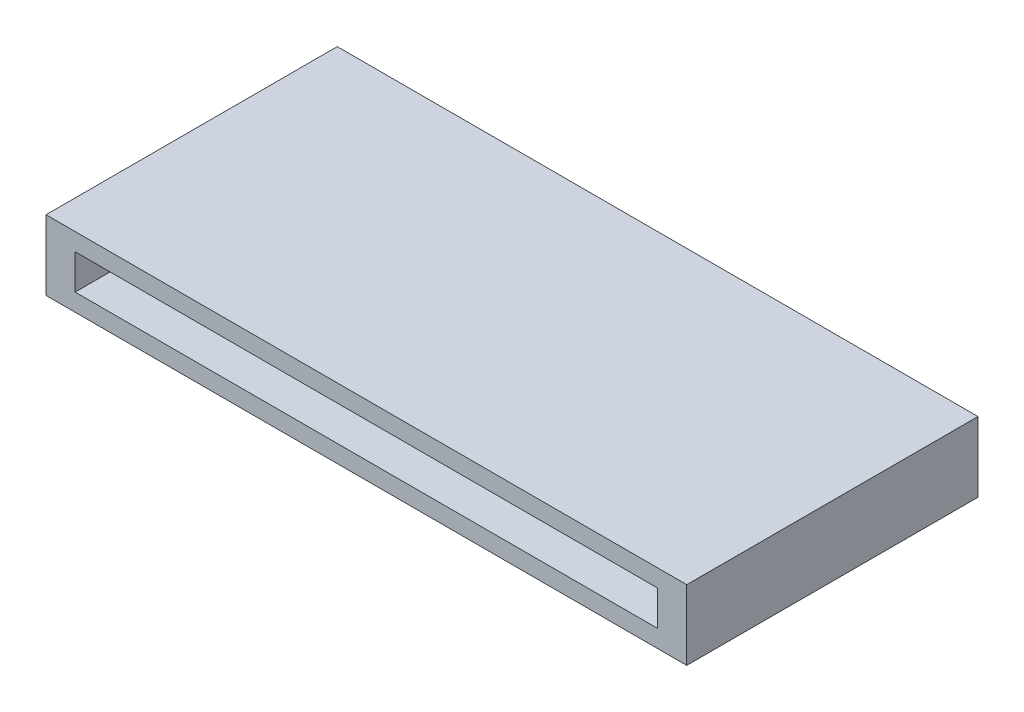
from build123d import *

# Parameters (mm, degrees)
SKETCH_1_W      = 11
SKETCH_1_H      = 1.2
SKETCH_1_W_2    = 10
SKETCH_1_H_2    = 0.6
EXTRUDE_1_DEPTH = 5


with BuildPart() as part:
    # 草图1 → 凸台-拉伸1 (new body)
    with BuildSketch(Plane.XY):
        Rectangle(SKETCH_1_W, SKETCH_1_H)
        Rectangle(SKETCH_1_W_2, SKETCH_1_H_2, mode=Mode.SUBTRACT)
    extrude(amount=EXTRUDE_1_DEPTH)


solid = part.part
